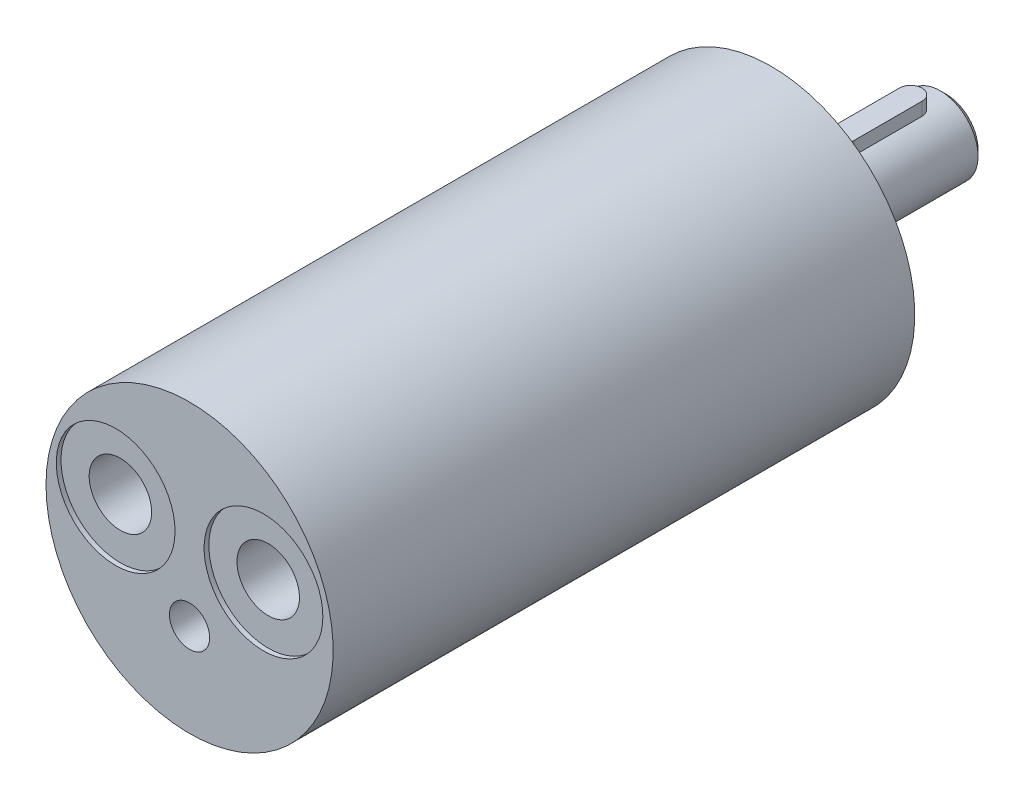
from build123d import *

# Parameters (mm, degrees)
SKETCH1_R                         = 30.099
BOSS_EXTRUDE1_DEPTH               = 121.92
CHAMFER1_SIZE                     = 1.27
CUT_EXTRUDE1_DEPTH                = 2.38125
BOSS_EXTRUDE2_DEPTH               = 4.7625
F_1_4_28_TAPPED_HOLE1_AT_2_COUNT  = 2
F_1_4_28_TAPPED_HOLE1_AT_2_PITCH  = 41.582709103
F_1_4_28_TAPPED_HOLE1_AT_3_COUNT  = 2
F_1_4_28_TAPPED_HOLE1_AT_3_PITCH  = 41.582709103
F_9_16_18_TAPPED_HOLE1_AT_2_COUNT = 2
F_9_16_18_TAPPED_HOLE1_AT_2_PITCH = 30.988
SKETCH11_R                        = 12.446
CUT_EXTRUDE2_DEPTH                = 0.9906
SKETCH14_W                        = 45.212
SKETCH14_H                        = 15.875


with BuildPart() as part:
    # Sketch1 → Boss-Extrude1 (new body)
    with BuildSketch(Plane.XY):
        Circle(SKETCH1_R)
    extrude(amount=BOSS_EXTRUDE1_DEPTH)

    # Sketch3 → Revolve1 (revolve)
    with BuildSketch(Plane(origin=(0, 0, 0), x_dir=(0, 0, -1), z_dir=(1, 0, 0))):
        Polygon((0, 15.748), (5.08, 15.748), (5.08, 7.9375), (36.703, 7.9375), (36.703, 0), (0, 0), align=None)
    revolve(axis=Axis((0, 0, 0), (0, 0, 1)))

    # Chamfer1
    chamfer1_edges = [part.edges().sort_by_distance(p)[0] for p in [
        (0, -7.9375, -36.703),
    ]]
    chamfer(chamfer1_edges, length=CHAMFER1_SIZE)

    # Sketch4 → Cut-Extrude1 (cut)
    with BuildSketch(Plane(origin=(0, 7.9375, 0), x_dir=(1, 0, 0), z_dir=(0, 1, 0))):
        with BuildLine():
            Line((2.38125, 29.24175), (2.38125, 14.95425))
            ThreePointArc((2.38125, 14.95425), (0, 12.573), (-2.38125, 14.95425))
            Line((-2.38125, 14.95425), (-2.38125, 29.24175))
            ThreePointArc((-2.38125, 29.24175), (0, 31.623), (2.38125, 29.24175))
        make_face()
    extrude(amount=-CUT_EXTRUDE1_DEPTH, mode=Mode.SUBTRACT)

    # Sketch7 → 1/4-28 Tapped Hole1 (revolve, cut)
    with BuildSketch(Plane(origin=(0, 22.5044, 0), x_dir=(0, 1, 0), z_dir=(1, 0, 0))):
        Polygon((0, 0), (0, 12.750588061), (2.7051, 11.1252), (2.7051, 0), align=None)
    f_1_4_28_tapped_hole1 = revolve(axis=Axis((0, 22.5044, -6.35), (0, 0, 1)), mode=Mode.SUBTRACT)

    # 1/4-28 Tapped Hole1 at 2: 1/4-28 Tapped Hole1 ×2
    with Locations(*[Vector(-0.3826834323650891, -0.9238795325112871, 0) * (i * F_1_4_28_TAPPED_HOLE1_AT_2_PITCH) for i in range(1, F_1_4_28_TAPPED_HOLE1_AT_2_COUNT)]):
        add(f_1_4_28_tapped_hole1, mode=Mode.SUBTRACT)

    # 1/4-28 Tapped Hole1 at 3: 1/4-28 Tapped Hole1 ×2
    with Locations(*[Vector(0.3826834323650891, -0.9238795325112871, 0) * (i * F_1_4_28_TAPPED_HOLE1_AT_3_PITCH) for i in range(1, F_1_4_28_TAPPED_HOLE1_AT_3_COUNT)]):
        add(f_1_4_28_tapped_hole1, mode=Mode.SUBTRACT)

    # Sketch9 → 9/16-18 Tapped Hole1 (revolve, cut)
    with BuildSketch(Plane(origin=(15.494, 5.1054, 121.92), x_dir=(0, -1, 0), z_dir=(1, 0, 0))):
        Polygon((0, 0), (0, 42.034507437), (6.54812, 38.1), (6.54812, 0), align=None)
    f_9_16_18_tapped_hole1 = revolve(axis=Axis((15.494, 5.1054, 128.27), (0, 0, -1)), mode=Mode.SUBTRACT)

    # 9/16-18 Tapped Hole1 at 2: 9/16-18 Tapped Hole1 ×2
    with Locations(*[(-i * F_9_16_18_TAPPED_HOLE1_AT_2_PITCH, 0, 0) for i in range(1, F_9_16_18_TAPPED_HOLE1_AT_2_COUNT)]):
        add(f_9_16_18_tapped_hole1, mode=Mode.SUBTRACT)

    # Sketch11 → Cut-Extrude2 (cut)
    with BuildSketch(Plane.XY.offset(121.92)):
        with Locations((-15.494, 5.1054)):
            Circle(SKETCH11_R)
        with Locations((15.494, 5.1054)):
            Circle(SKETCH11_R)
    extrude(amount=-CUT_EXTRUDE2_DEPTH, mode=Mode.SUBTRACT)

    # Sketch12 → 3/8-24 Tapped Hole1 (revolve, cut)
    with BuildSketch(Plane(origin=(0, -10.5918, 121.92), x_dir=(0, -1, 0), z_dir=(1, 0, 0))):
        Polygon((0, 0), (0, 26.892068714), (4.2164, 24.3586), (4.2164, 0), align=None)
    revolve(axis=Axis((0, -10.5918, 128.27), (0, 0, -1)), mode=Mode.SUBTRACT)

    # Sketch14 → Cut-Revolve1 (revolve, cut)
    with BuildSketch(Plane(origin=(0, 0, 0), x_dir=(0, 0, -1), z_dir=(1, 0, 0))):
        with Locations((-48.006, 7.9375)):
            Rectangle(SKETCH14_W, SKETCH14_H)
    revolve(axis=Axis((0, 0, 0), (0, 0, 1)), mode=Mode.SUBTRACT)

    # Sketch18 → 1/4-28 Tapped Hole2 (revolve, cut)
    with BuildSketch(Plane(origin=(0, 0, -36.703), x_dir=(0, 1, 0), z_dir=(1, 0, 0))):
        Polygon((0, 0), (0, 17.500388061), (2.7051, 15.875), (2.7051, 1.453663038), (3.96875, 0), align=None)
    revolve(axis=Axis((0, 0, -43.053), (0, 0, 1)), mode=Mode.SUBTRACT)


with BuildPart() as body_2:
    # Sketch5 → Boss-Extrude2 (new body)
    with BuildSketch(Plane(origin=(0, 5.55625, 0), x_dir=(1, 0, 0), z_dir=(0, 1, 0))):
        with BuildLine():
            Line((2.38125, 29.24175), (2.38125, 14.95425))
            ThreePointArc((2.38125, 14.95425), (0, 12.573), (-2.38125, 14.95425))
            Line((-2.38125, 14.95425), (-2.38125, 29.24175))
            ThreePointArc((-2.38125, 29.24175), (0, 31.623), (2.38125, 29.24175))
        make_face()
    extrude(amount=BOSS_EXTRUDE2_DEPTH)


solid = Compound([part.part, body_2.part])
